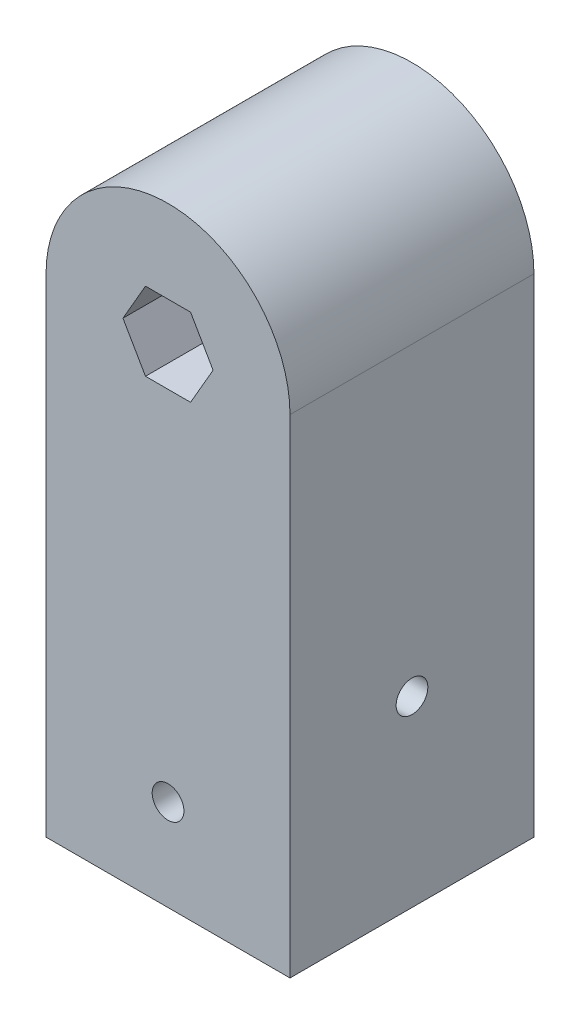
from build123d import *

# Parameters (mm, degrees)
BOSS_EXTRUDE1_DEPTH     = 10
SKETCH3_R               = 4.9
CUT_EXTRUDE1_DEPTH      = 20
CUT_EXTRUDE2_DEPTH      = 43.426406871
CUT_EXTRUDE2_DEPTH_BACK = 43.426406871
SKETCH4_R               = 1.3
CUT_EXTRUDE3_DEPTH      = 43.426406989
CUT_EXTRUDE3_DEPTH_BACK = 43.426406989
SKETCH5_R               = 1.3


with BuildPart() as part:
    # Sketch2 → Boss-Extrude1 (new, symmetric)
    with BuildSketch(Plane.XY):
        with BuildLine():
            Line((-10, 0), (-10, -40))
            Line((-10, -40), (10, -40))
            Line((10, -40), (10, 0))
            ThreePointArc((10, 0), (0, 10), (-10, 0))
        make_face()
        Polygon((3.695041723, 0), (1.847520861, 3.2), (-1.847520861, 3.2), (-3.695041723, 0), (-1.847520861, -3.2), (1.847520861, -3.2), align=None, mode=Mode.SUBTRACT)
    extrude(amount=BOSS_EXTRUDE1_DEPTH, both=True)

    # Sketch3 → Cut-Extrude1 (cut)
    with BuildSketch(Plane.XZ.offset(40)):
        with Locations(Location((0, 0, 0), (0, 0, 270))):
            Circle(SKETCH3_R)
    extrude(amount=-CUT_EXTRUDE1_DEPTH, mode=Mode.SUBTRACT)

    # Sketch4 → Cut-Extrude2 (cut, two sides: drawn at the far end of the back side and taken through both)
    with BuildSketch(Plane.XY.offset(-CUT_EXTRUDE2_DEPTH_BACK)):
        with Locations((0, -32.5)):
            Circle(SKETCH4_R)
    extrude(amount=CUT_EXTRUDE2_DEPTH + CUT_EXTRUDE2_DEPTH_BACK, mode=Mode.SUBTRACT)

    # Sketch5 → Cut-Extrude3 (cut, two sides: drawn at the far end of the back side and taken through both)
    with BuildSketch(Plane(origin=(0, 0, 0), x_dir=(0, 0, -1), z_dir=(1, 0, 0)).offset(-CUT_EXTRUDE3_DEPTH_BACK)):
        with Locations((0, -25)):
            Circle(SKETCH5_R)
    extrude(amount=CUT_EXTRUDE3_DEPTH + CUT_EXTRUDE3_DEPTH_BACK, mode=Mode.SUBTRACT)


solid = part.part
